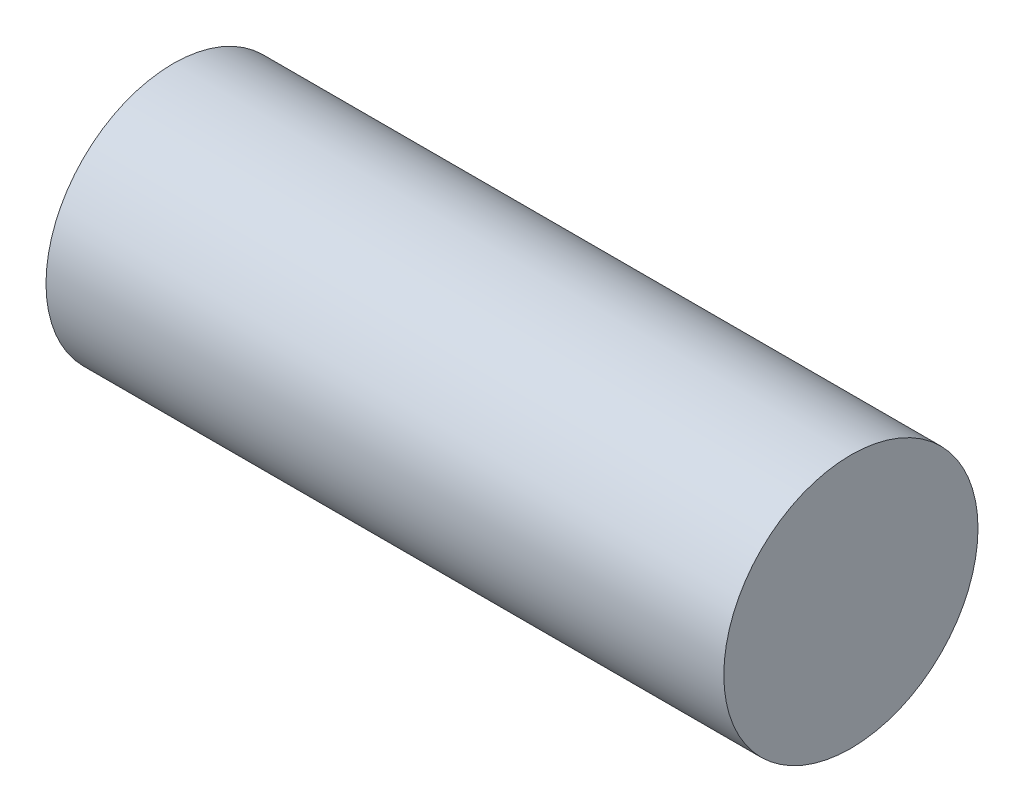
from build123d import *

# Parameters (mm, degrees)
SKETCH2_R           = 3
BOSS_EXTRUDE2_DEPTH = 16


with BuildPart() as part:
    # Sketch2 → Boss-Extrude2 (new body)
    with BuildSketch(Plane(origin=(0, 0, 0), x_dir=(0, 0, -1), z_dir=(1, 0, 0))):
        Circle(SKETCH2_R)
    extrude(amount=BOSS_EXTRUDE2_DEPTH)


solid = part.part
